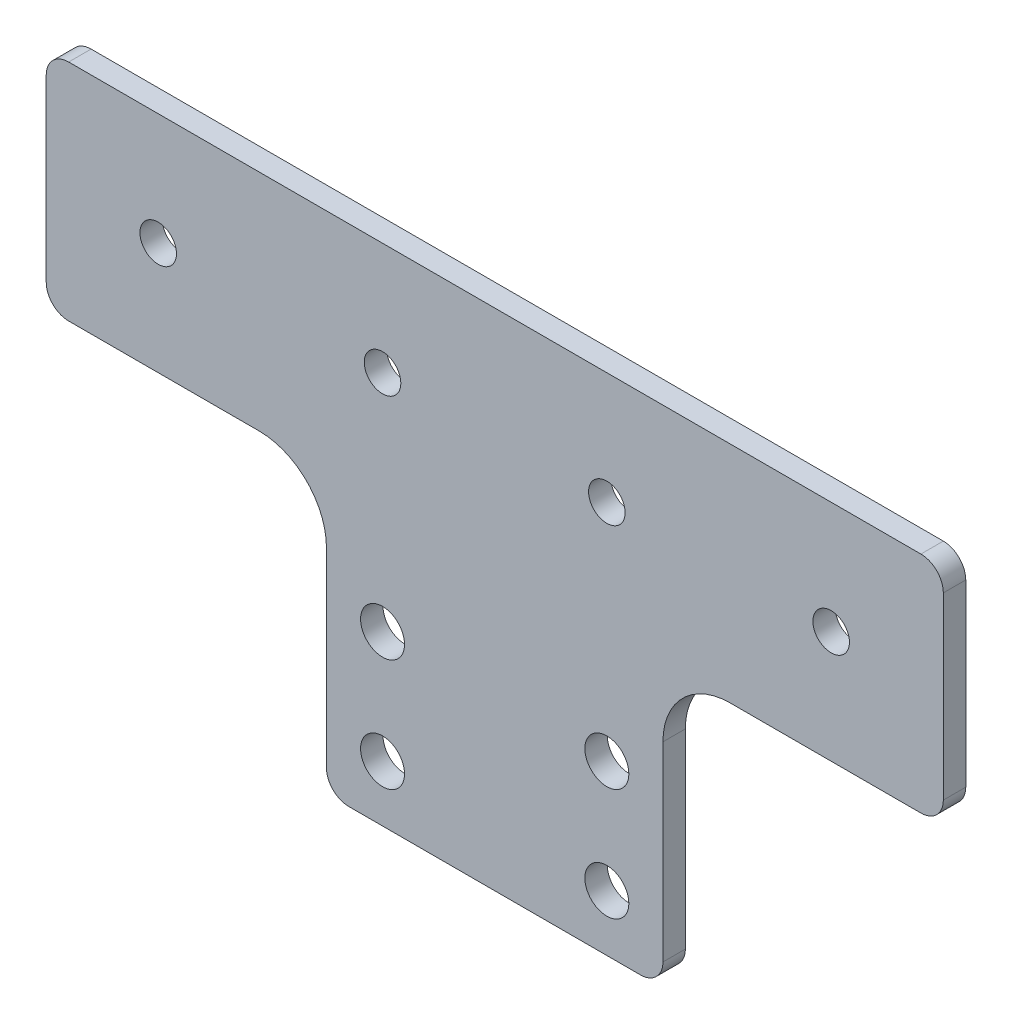
from build123d import *

# Parameters (mm, degrees)
SKETCH1_R           = 2.0701
SKETCH1_R_2         = 2.4892
BOSS_EXTRUDE1_DEPTH = 2.54


with BuildPart() as part:
    # Sketch1 → Boss-Extrude1 (new body)
    with BuildSketch(Plane.XY):
        with BuildLine():
            Line((-35.539454624, 50.8), (60.96, 50.8))
            ThreePointArc((60.96, 50.8), (62.756051224, 50.056051224), (63.5, 48.26))
            Line((63.5, 48.26), (63.5, 27.94))
            ThreePointArc((63.5, 27.94), (62.756051224, 26.143948776), (60.96, 25.4))
            Line((60.96, 25.4), (39.37, 25.4))
            ThreePointArc((39.37, 25.4), (33.981846327, 23.168153673), (31.75, 17.78))
            Line((31.75, 17.78), (31.75, -3.81))
            ThreePointArc((31.75, -3.81), (31.006051224, -5.606051224), (29.21, -6.35))
            Line((29.21, -6.35), (-3.81, -6.35))
            ThreePointArc((-3.81, -6.35), (-5.606051224, -5.606051224), (-6.35, -3.81))
            Line((-6.35, -3.81), (-6.35, 17.78))
            ThreePointArc((-6.35, 17.78), (-8.581846327, 23.168153673), (-13.97, 25.4))
            Line((-13.97, 25.4), (-35.539454624, 25.4))
            ThreePointArc((-35.539454624, 25.4), (-37.335505848, 26.143948776), (-38.079454624, 27.94))
            Line((-38.079454624, 27.94), (-38.079454624, 48.26))
            ThreePointArc((-38.079454624, 48.26), (-37.335505848, 50.056051224), (-35.539454624, 50.8))
        make_face()
        with Locations((-25.4, 38.1)):
            Circle(SKETCH1_R, mode=Mode.SUBTRACT)
        with Locations((0, 38.1)):
            Circle(SKETCH1_R, mode=Mode.SUBTRACT)
        with Locations((25.4, 38.1)):
            Circle(SKETCH1_R, mode=Mode.SUBTRACT)
        with Locations((50.8, 38.1)):
            Circle(SKETCH1_R, mode=Mode.SUBTRACT)
        with Locations((0, 12.7)):
            Circle(SKETCH1_R_2, mode=Mode.SUBTRACT)
        Circle(SKETCH1_R_2, mode=Mode.SUBTRACT)
        with Locations((25.4, 12.7)):
            Circle(SKETCH1_R_2, mode=Mode.SUBTRACT)
        with Locations((25.4, 0)):
            Circle(SKETCH1_R_2, mode=Mode.SUBTRACT)
    extrude(amount=BOSS_EXTRUDE1_DEPTH)


solid = part.part
